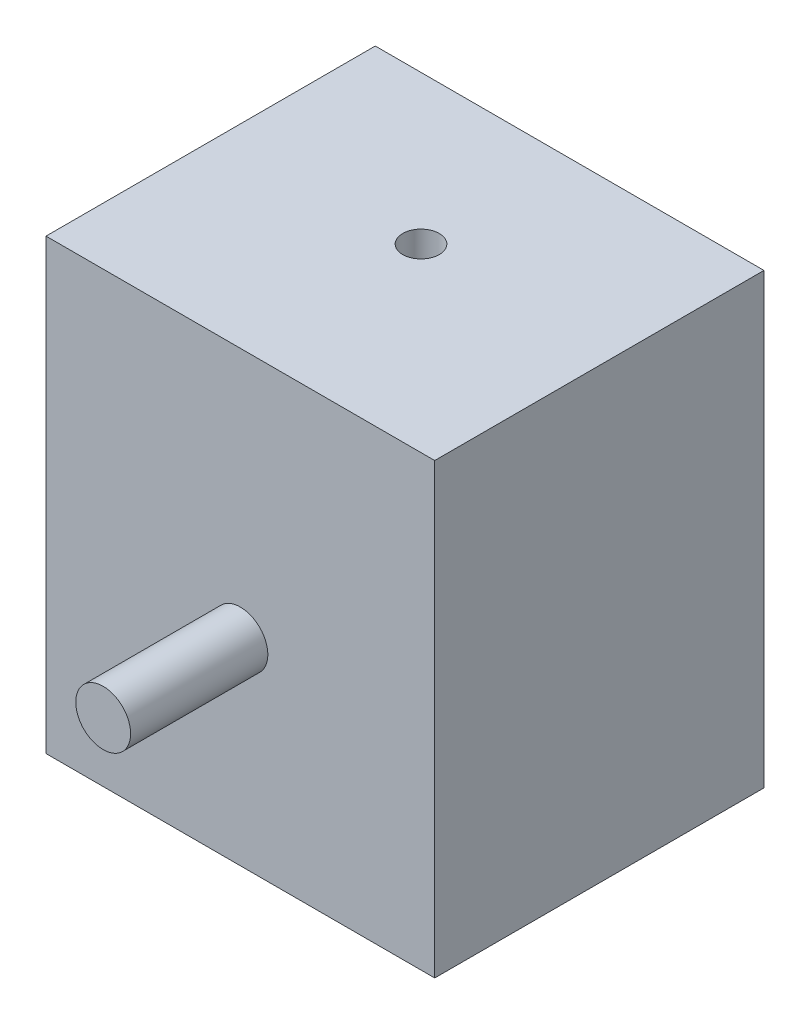
from build123d import *

# Parameters (mm, degrees)
SKETCH1_W           = 85
SKETCH1_H           = 72
BOSS_EXTRUDE1_DEPTH = 98
SKETCH2_R           = 4
CUT_EXTRUDE1_DEPTH  = 10
SKETCH3_R           = 6
BOSS_EXTRUDE2_DEPTH = 30


with BuildPart() as part:
    # Sketch1 → Boss-Extrude1 (new body)
    with BuildSketch(Plane(origin=(0, 0, 0), x_dir=(1, 0, 0), z_dir=(0, 1, 0))):
        Rectangle(SKETCH1_W, SKETCH1_H)
    extrude(amount=BOSS_EXTRUDE1_DEPTH)

    # Sketch2 → Cut-Extrude1 (cut)
    with BuildSketch(Plane(origin=(0, 98, 0), x_dir=(1, 0, 0), z_dir=(0, 1, 0))):
        with Locations(Location((0, 3.5, 0), (0, 0, 270))):
            Circle(SKETCH2_R)
    extrude(amount=-CUT_EXTRUDE1_DEPTH, mode=Mode.SUBTRACT)

    # Sketch3 → Boss-Extrude2 (add)
    with BuildSketch(Plane.XY.offset(36)):
        with Locations(Location((0, 43, 0), (0, 0, 180))):
            Circle(SKETCH3_R)
    extrude(amount=BOSS_EXTRUDE2_DEPTH)


solid = part.part
